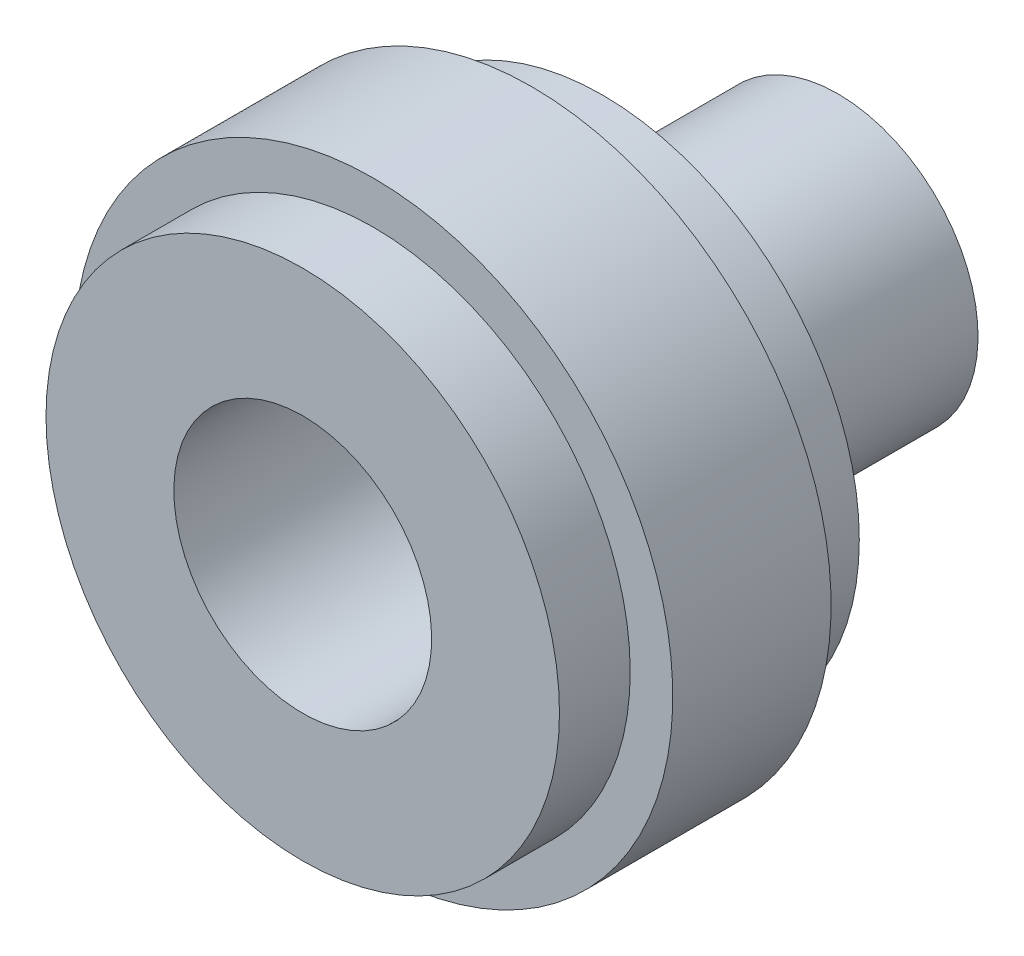
from build123d import *


with BuildPart() as part:
    # Sketch2 → Revolve1 (revolve)
    with BuildSketch(Plane(origin=(0, 0, 0), x_dir=(0, 0, -1), z_dir=(1, 0, 0))):
        Polygon((-5.4356, 4.6736), (1.1938, 4.6736), (1.1938, 1.7526), (13.97, 1.7526), (13.97, 5.08), (5.4356, 5.08), (5.4356, 9.3091), (2.8702, 9.3091), (2.8702, 10.85215), (-2.8702, 10.85215), (-2.8702, 9.3091), (-5.4356, 9.3091), align=None)
    revolve(axis=Axis((0, 0, 0), (0, 0, 1)))


solid = part.part
